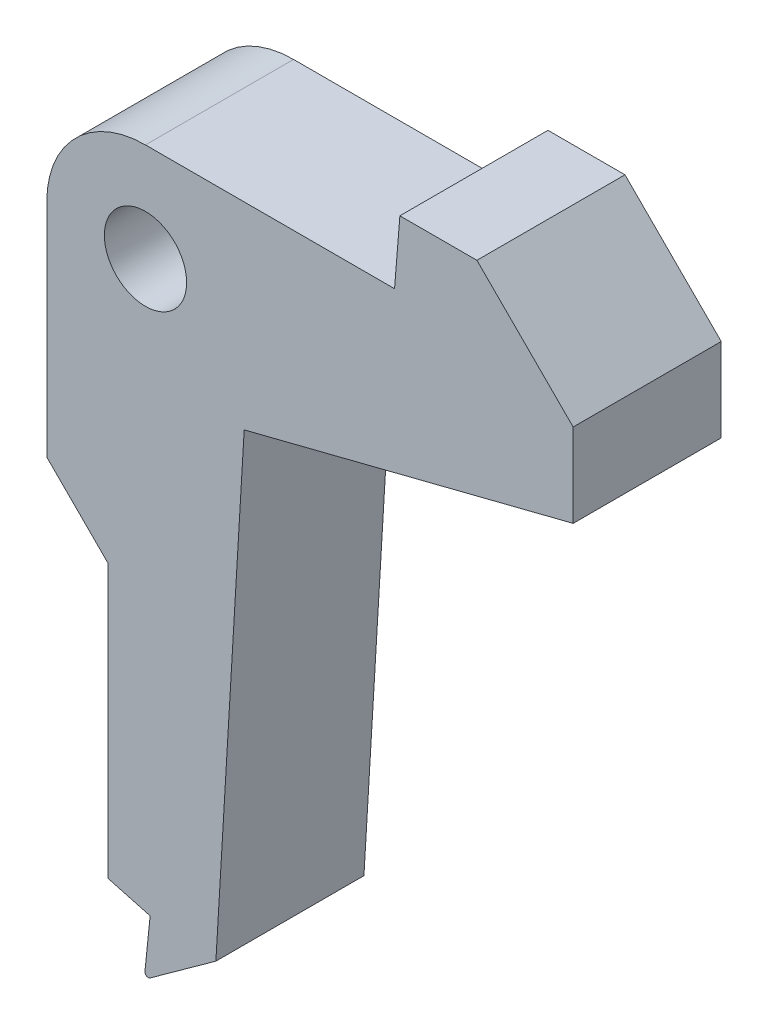
from build123d import *

# Parameters (mm, degrees)
SKETCH_1_R      = 6
SKETCH_1_R_2    = 2.5
EXTRUDE_1_DEPTH = 9


with BuildPart() as part:
    # 스케치1 → 보스-돌출1 (new body)
    # profile 1 of 2: a face of its own
    with BuildSketch(Plane.XY):
        with BuildLine():
            Line((15.138175611, 6), (0, 6))
            ThreePointArc((0, 6), (4.242640687, 4.242640687), (6, 0))
            ThreePointArc((6, 0), (0, -6), (-6, 0))
            Line((-6, 0), (-6, -13.433276283))
            Line((-6, -13.433276283), (-2.272089827, -17.161186456))
            Line((-2.272089827, -17.161186456), (-2.272089827, -33.747703831))
            Line((-2.272089827, -33.747703831), (0.282693742, -34.440633794))
            Line((0.282693742, -34.440633794), (-0.033215199, -37.525789008))
            ThreePointArc((-0.033215199, -37.525789008), (0.065651627, -37.719313216), (0.282693742, -37.70840501))
            Line((0.282693742, -37.70840501), (4.278390118, -34.828200083))
            Line((4.278390118, -34.828200083), (6, -6))
            Line((6, -6), (25.995290484, -0.925171702))
            Line((25.995290484, -0.925171702), (25.995290484, 4.149656597))
            Line((25.995290484, 4.149656597), (20.144947081, 10))
            Line((20.144947081, 10), (15.462448132, 10))
            Line((15.462448132, 10), (15.138175611, 6))
        make_face()
    # profile 2 of 2: a face of its own
    with BuildSketch(Plane.XY):
        Circle(SKETCH_1_R)
        Circle(SKETCH_1_R_2, mode=Mode.SUBTRACT)
    extrude(amount=EXTRUDE_1_DEPTH)


solid = part.part
